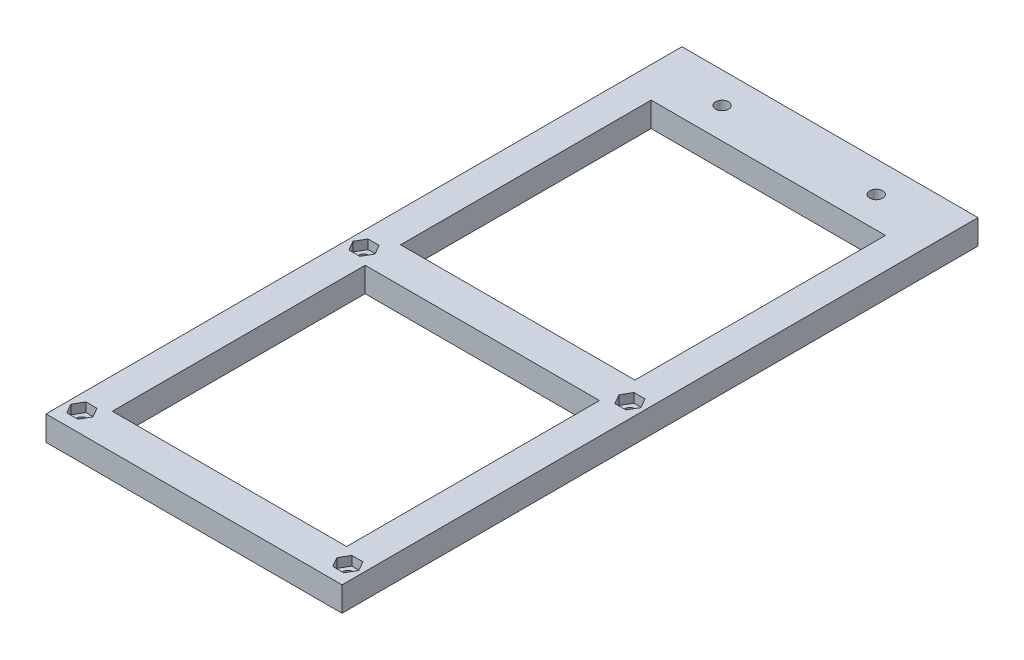
from build123d import *

# Parameters (mm, degrees)
SKETCH_1_W               = 96
SKETCH_1_H               = 105
SKETCH_1_R               = 1.75
SKETCH_1_W_2             = 76
SKETCH_1_H_2             = 82
EXTRUDE_1_DEPTH          = 8
SKETCH_1_11_R            = 1.75
SKETCH_1_11_W            = 76
SKETCH_1_11_H            = 82
SKETCH_1_11_R_2          = 2.1
SKETCH_1_11_H_2          = 81.25
EXTRUDE_5_DEPTH          = 8
CUT_EXTRUDE_4_DEPTH      = 162.267053362
CUT_EXTRUDE_4_DEPTH_BACK = 162.267053362
SKETCH_1_12_W            = 76
SKETCH_1_12_H            = 81.25
SKETCH_3_R               = 6.1
CUT_EXTRUDE_5_DEPTH      = 4
CUT_EXTRUDE_6_DEPTH      = 3


with BuildPart() as part:
    # Эскиз1 → Бобышка-Вытянуть1 (new body)
    with BuildSketch(Plane(origin=(0, 0, 0), x_dir=(1, 0, 0), z_dir=(0, 1, 0))):
        Rectangle(SKETCH_1_W, SKETCH_1_H)
        with Locations(Location((-43.125, 45.75, 0), (0, 0, 270))):
            Circle(SKETCH_1_R, mode=Mode.SUBTRACT)
        with Locations(Location((43.125, 45.75, 0), (0, 0, 270))):
            Circle(SKETCH_1_R, mode=Mode.SUBTRACT)
        with Locations(Location((43.125, -45.75, 0), (0, 0, 270))):
            Circle(SKETCH_1_R, mode=Mode.SUBTRACT)
        with Locations(Location((-43.125, -45.75, 0), (0, 0, 270))):
            Circle(SKETCH_1_R, mode=Mode.SUBTRACT)
        Rectangle(SKETCH_1_W_2, SKETCH_1_H_2, mode=Mode.SUBTRACT)
    extrude(amount=EXTRUDE_1_DEPTH)

    # Эскиз1<11> → Бобышка-Вытянуть5 (add)
    # profile 1 of 3: a face of its own
    with BuildSketch(Plane(origin=(0, 0, 0), x_dir=(1, 0, 0), z_dir=(0, 1, 0))):
        Polygon((-48, -52.5), (48, -52.5), (48, 52.5), (38, 52.5), (-38, 52.5), (-48, 52.5), align=None)
        with Locations(Location((-43.125, -45.75, 0), (0, 0, 270))):
            Circle(SKETCH_1_11_R, mode=Mode.SUBTRACT)
        with Locations(Location((-43.125, 45.75, 0), (0, 0, 270))):
            Circle(SKETCH_1_11_R, mode=Mode.SUBTRACT)
        with Locations(Location((43.125, -45.75, 0), (0, 0, 270))):
            Circle(SKETCH_1_11_R, mode=Mode.SUBTRACT)
        Rectangle(SKETCH_1_11_W, SKETCH_1_11_H, mode=Mode.SUBTRACT)
        with Locations(Location((43.125, 45.75, 0), (0, 0, 270))):
            Circle(SKETCH_1_11_R, mode=Mode.SUBTRACT)
    # profile 2 of 3: a face of its own
    with BuildSketch(Plane(origin=(0, 0, 0), x_dir=(1, 0, 0), z_dir=(0, 1, 0))):
        Polygon((38, 52.5), (48, 52.5), (48, 153.75), (-48, 153.75), (-48, 52.5), (-38, 52.5), (-38, 133.75), (38, 133.75), align=None)
        with Locations(Location((-25, 143.75, 0), (0, 0, 270))):
            Circle(SKETCH_1_11_R_2, mode=Mode.SUBTRACT)
        with Locations(Location((25, 143.75, 0), (0, 0, 270))):
            Circle(SKETCH_1_11_R_2, mode=Mode.SUBTRACT)
    # profile 3 of 3: a face of its own
    with BuildSketch(Plane(origin=(0, 0, 0), x_dir=(1, 0, 0), z_dir=(0, 1, 0))):
        with Locations((0, 93.125)):
            Rectangle(SKETCH_1_11_W, SKETCH_1_11_H_2)
    extrude(amount=EXTRUDE_5_DEPTH)

    # Эскиз1<12> → Вырез-Вытянуть4 (cut, two sides: drawn at the far end of the back side and taken through both)
    with BuildSketch(Plane(origin=(0, 0, 0), x_dir=(1, 0, 0), z_dir=(0, 1, 0)).offset(-CUT_EXTRUDE_4_DEPTH_BACK)):
        with Locations((0, 93.125)):
            Rectangle(SKETCH_1_12_W, SKETCH_1_12_H)
    extrude(amount=CUT_EXTRUDE_4_DEPTH + CUT_EXTRUDE_4_DEPTH_BACK, mode=Mode.SUBTRACT)

    # Эскиз3 → Вырез-Вытянуть5 (cut)
    with BuildSketch(Plane.XZ):
        with Locations(Location((-25, -143.75, 0), (0, 0, 270))):
            Circle(SKETCH_3_R)
        with Locations(Location((25, -143.75, 0), (0, 0, 270))):
            Circle(SKETCH_3_R)
    extrude(amount=-CUT_EXTRUDE_5_DEPTH, mode=Mode.SUBTRACT)

    # Эскиз4 → Вырез-Вытянуть6 (cut)
    with BuildSketch(Plane(origin=(0, 8, 0), x_dir=(1, 0, 0), z_dir=(0, 1, 0))):
        Polygon((-39.545428331, 45.75), (-41.335214166, 48.85), (-44.914785834, 48.85), (-46.704571669, 45.75), (-44.914785834, 42.65), (-41.335214166, 42.65), align=None)
        Polygon((39.545428331, 45.75), (41.335214166, 42.65), (44.914785834, 42.65), (46.704571669, 45.75), (44.914785834, 48.85), (41.335214166, 48.85), align=None)
        Polygon((39.545428331, -45.75), (41.335214166, -48.85), (44.914785834, -48.85), (46.704571669, -45.75), (44.914785834, -42.65), (41.335214166, -42.65), align=None)
        Polygon((-39.545428331, -45.75), (-41.335214166, -42.65), (-44.914785834, -42.65), (-46.704571669, -45.75), (-44.914785834, -48.85), (-41.335214166, -48.85), align=None)
    extrude(amount=-CUT_EXTRUDE_6_DEPTH, mode=Mode.SUBTRACT)


solid = part.part
